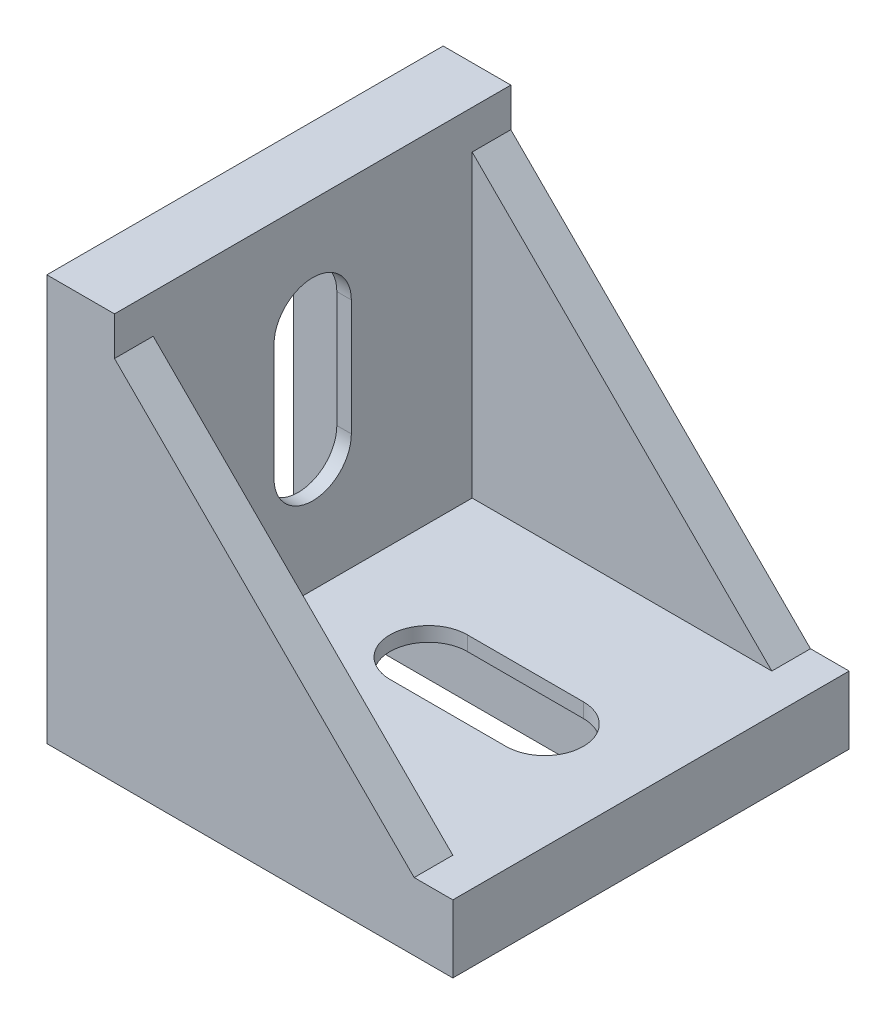
from build123d import *

# Parameters (mm, degrees)
AUFSATZ_LINEAR_AUSTRAGEN1_DEPTH = 20.5
SKIZZE2_W                       = 33
SKIZZE2_H                       = 31
SCHNITT_LINEAR_AUSTRAGEN1_DEPTH = 35
SCHNITT_LINEAR_AUSTRAGEN2_DEPTH = 10
SCHNITT_LINEAR_AUSTRAGEN3_DEPTH = 10
SKIZZE5_W                       = 9.5
SKIZZE5_H                       = 36
SKIZZE5_W_2                     = 10
SKIZZE5_H_2                     = 28
SCHNITT_LINEAR_AUSTRAGEN4_DEPTH = 5.5
SKIZZE6_W                       = 28
SKIZZE6_H                       = 10
SKIZZE6_W_2                     = 36
SKIZZE6_H_2                     = 9.5
SCHNITT_LINEAR_AUSTRAGEN5_DEPTH = 5.5
AUFSATZ_LINEAR_AUSTRAGEN2_DEPTH = 9.5
AUFSATZ_LINEAR_AUSTRAGEN3_DEPTH = 9.5


with BuildPart() as part:
    # Skizze1 → Aufsatz-Linear austragen1 (new, symmetric)
    with BuildSketch(Plane.XY):
        Polygon((0, 0), (42, 0), (42, 7), (38, 7), (7, 38), (7, 42), (0, 42), align=None)
    extrude(amount=AUFSATZ_LINEAR_AUSTRAGEN1_DEPTH, both=True)

    # Skizze2 → Schnitt-Linear austragen1 (cut)
    with BuildSketch(Plane(origin=(42, 0, 0), x_dir=(0, 0, -1), z_dir=(1, 0, 0))):
        with Locations((0, 22.5)):
            Rectangle(SKIZZE2_W, SKIZZE2_H)
    extrude(amount=-SCHNITT_LINEAR_AUSTRAGEN1_DEPTH, mode=Mode.SUBTRACT)

    # Skizze3 → Schnitt-Linear austragen2 (cut)
    with BuildSketch(Plane(origin=(7, 0, 0), x_dir=(0, 0, -1), z_dir=(1, 0, 0))):
        with BuildLine():
            Line((-4, 19), (-4, 31))
            ThreePointArc((-4, 31), (0, 35), (4, 31))
            Line((4, 31), (4, 19))
            ThreePointArc((4, 19), (0, 15), (-4, 19))
        make_face()
    extrude(amount=-SCHNITT_LINEAR_AUSTRAGEN2_DEPTH, mode=Mode.SUBTRACT)

    # Skizze4 → Schnitt-Linear austragen3 (cut)
    with BuildSketch(Plane(origin=(0, 7, 0), x_dir=(1, 0, 0), z_dir=(0, 1, 0))):
        with BuildLine():
            Line((19, 4), (31, 4))
            ThreePointArc((31, 4), (35, 0), (31, -4))
            Line((31, -4), (19, -4))
            ThreePointArc((19, -4), (15, 0), (19, 4))
        make_face()
    extrude(amount=-SCHNITT_LINEAR_AUSTRAGEN3_DEPTH, mode=Mode.SUBTRACT)

    # Skizze5 → Schnitt-Linear austragen4 (cut)
    with BuildSketch(Plane.ZY):
        with Locations((12.75, 21)):
            Rectangle(SKIZZE5_W, SKIZZE5_H)
        with Locations((0, 22)):
            Rectangle(SKIZZE5_W_2, SKIZZE5_H_2)
        with Locations((-12.75, 21)):
            Rectangle(SKIZZE5_W, SKIZZE5_H)
    extrude(amount=-SCHNITT_LINEAR_AUSTRAGEN4_DEPTH, mode=Mode.SUBTRACT)

    # Skizze6 → Schnitt-Linear austragen5 (cut)
    with BuildSketch(Plane.XZ):
        with Locations((22, 0)):
            Rectangle(SKIZZE6_W, SKIZZE6_H)
        with Locations((21, 12.75)):
            Rectangle(SKIZZE6_W_2, SKIZZE6_H_2)
        with Locations((21, -12.75)):
            Rectangle(SKIZZE6_W_2, SKIZZE6_H_2)
    extrude(amount=-SCHNITT_LINEAR_AUSTRAGEN5_DEPTH, mode=Mode.SUBTRACT)

    # Skizze7 → Aufsatz-Linear austragen2 (add)
    with BuildSketch(Plane.XY.offset(8)):
        Polygon((3, 0.5), (8, 5.5), (5.5, 5.5), (5.5, 8), (0.5, 3), (3, 3), align=None)
    extrude(amount=AUFSATZ_LINEAR_AUSTRAGEN2_DEPTH)

    # Skizze8 → Aufsatz-Linear austragen3 (add)
    with BuildSketch(Plane.XY.offset(-17.5)):
        Polygon((3, 0.5), (8, 5.5), (5.5, 5.5), (5.5, 8), (0.5, 3), (3, 3), align=None)
    extrude(amount=AUFSATZ_LINEAR_AUSTRAGEN3_DEPTH)


solid = part.part
